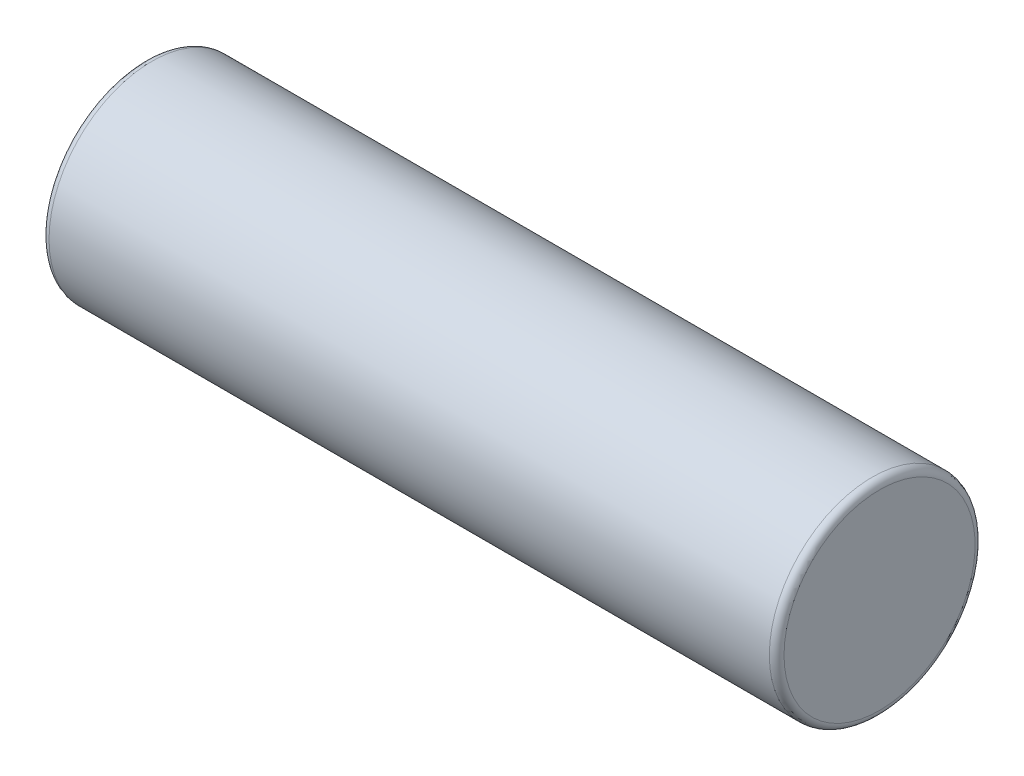
from build123d import *

# Parameters (mm, degrees)
SKETCH_1_W = 50
SKETCH_1_H = 7
FILLET_1_R = 0.5


with BuildPart() as part:
    # Эскиз1 → Повернуть1 (revolve)
    with BuildSketch(Plane.XY, mode=Mode.PRIVATE) as revolve_1_sk:
        with Locations((25, 3.5)):
            Rectangle(SKETCH_1_W, SKETCH_1_H)
    revolve(revolve_1_sk.sketch.rotate(Axis((0, 0, 0), (1, 0, 0)), 90), axis=Axis((0, 0, 0), (1, 0, 0)))

    # Скругление1
    fillet_1_edges = [part.edges().sort_by_distance(p)[0] for p in [
        (50, 0, -7),
        (0, 0, -7),
    ]]
    fillet(fillet_1_edges, radius=FILLET_1_R)


solid = part.part
